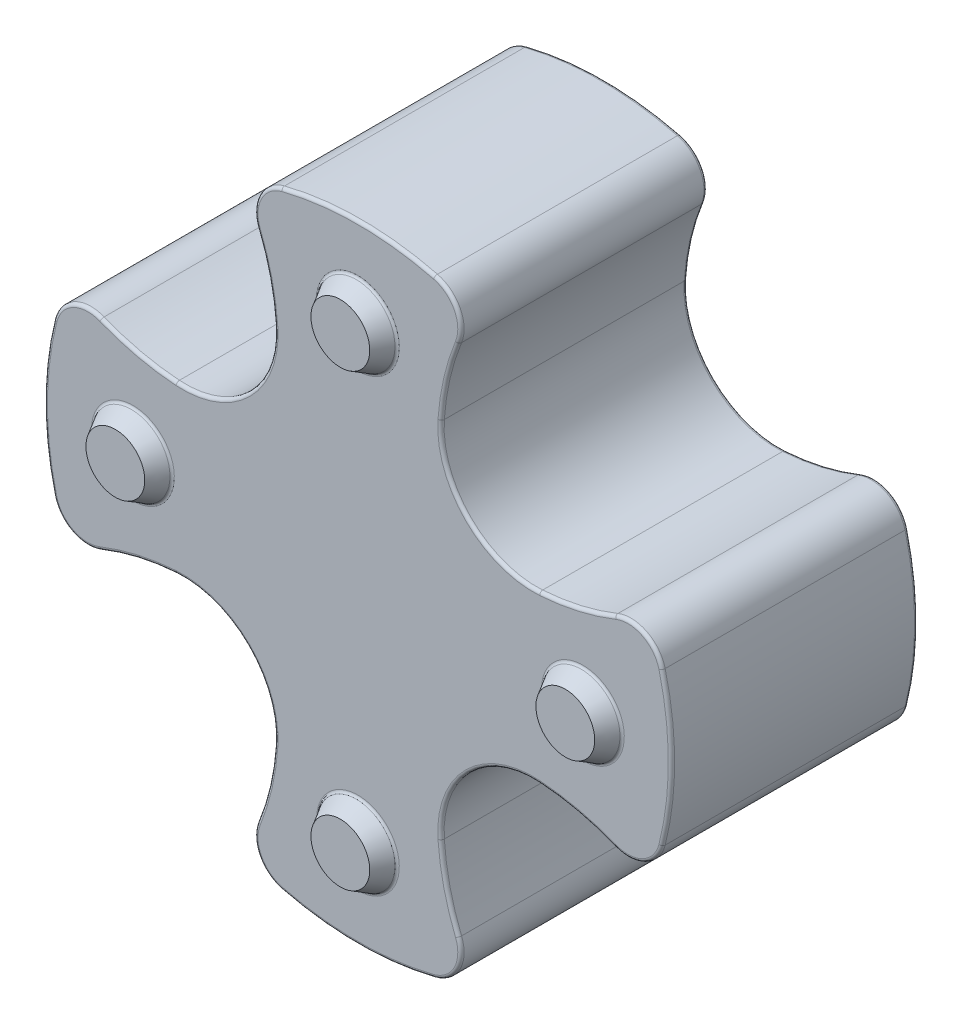
from build123d import *

# Parameters (mm, degrees)
BOSS_EXTRUDE1_DEPTH = 5.334
SKETCH5_R           = 1.7145
BOSS_EXTRUDE3_DEPTH = 0.762
BOSS_EXTRUDE3_TAPER = 30
CIRPATTERN1_COUNT   = 4
FILLET3_R           = 0.13716


with BuildPart() as part:
    # Sketch3 → Boss-Extrude1 (new body)
    with BuildSketch(Plane.XY):
        with BuildLine():
            Line((0, 0), (-4.768515788, 4.768516212))
            ThreePointArc((-4.768515788, 4.768516212), (-3.85125366, 6.193629783), (-3.606569915, 7.870665373))
            ThreePointArc((-3.606569915, 7.870665373), (-3.85264508, 9.530618394), (-4.355380176, 11.131635084))
            ThreePointArc((-4.355380176, 11.131635084), (-4.299852857, 12.392230924), (-3.313267616, 13.178891407))
            ThreePointArc((-3.313267616, 13.178891407), (0, 13.589), (3.313267616, 13.178891407))
            ThreePointArc((3.313267616, 13.178891407), (4.299852791, 12.392231053), (4.355380284, 11.131635354))
            ThreePointArc((4.355380284, 11.131635354), (3.852645214, 9.530617348), (3.606570473, 7.870663004))
            ThreePointArc((3.606570473, 7.870663004), (3.85125457, 6.19362848), (4.768516212, 4.768515788))
            Line((4.768516212, 4.768515788), (0, 0))
        make_face()
    extrude(amount=BOSS_EXTRUDE1_DEPTH)

    # Sketch5 → Boss-Extrude3 (add)
    with BuildSketch(Plane.XY.offset(5.334)):
        with Locations((0, 9.749626986)):
            Circle(SKETCH5_R)
    extrude(amount=BOSS_EXTRUDE3_DEPTH, taper=BOSS_EXTRUDE3_TAPER)


with BuildPart() as cirpattern1_1:
    # CirPattern1: pattern copy
    add(part.part.rotate(Axis((0, 0, 0), (0, 0, 1)), 1 * 360 / CIRPATTERN1_COUNT))


with BuildPart() as cirpattern1_2:
    # CirPattern1: pattern copy
    add(part.part.rotate(Axis((0, 0, 0), (0, 0, 1)), 2 * 360 / CIRPATTERN1_COUNT))


with BuildPart() as cirpattern1_3:
    # CirPattern1: pattern copy
    add(part.part.rotate(Axis((0, 0, 0), (0, 0, 1)), 3 * 360 / CIRPATTERN1_COUNT))


with BuildPart() as cirpattern1_1_1:
    add(cirpattern1_1.part)

    # Combine1: union part, CirPattern1_3, CirPattern1_2
    add(part.part)
    add(cirpattern1_3.part)
    add(cirpattern1_2.part)

    # Fillet3
    fillet3_edges = [cirpattern1_1_1.edges().sort_by_distance(p)[0] for p in [
        (-12.392231053, 4.299852791, 5.334),
        (-13.589, 0, 5.334),
        (-12.392230924, -4.299852857, 5.334),
        (-9.530618394, -3.85264508, 5.334),
        (-4.768516938, -4.768515063, 5.334),
        (-9.749626986, -1.7145, 5.334),
        (-4.768515063, 4.768516938, 5.334),
        (4.768516938, 4.768515063, 5.334),
        (3.852645214, 9.530617348, 5.334),
        (4.299852791, 12.392231053, 5.334),
        (0, 13.589, 5.334),
        (-4.299852857, 12.392230924, 5.334),
        (-3.85264508, 9.530618394, 5.334),
        (-3.852645214, -9.530617348, 5.334),
        (-4.299852791, -12.392231053, 5.334),
        (0, -13.589, 5.334),
        (4.299852857, -12.392230924, 5.334),
        (3.85264508, -9.530618394, 5.334),
        (4.768515063, -4.768516938, 5.334),
        (9.530617348, -3.852645214, 5.334),
        (12.392231053, -4.299852791, 5.334),
        (13.589, 0, 5.334),
        (12.392230924, 4.299852857, 5.334),
        (9.530618394, 3.85264508, 5.334),
        (-1.7145, 9.749626986, 5.334),
        (9.749626986, 1.7145, 5.334),
        (1.7145, -9.749626986, 5.334),
        (-9.530617348, 3.852645214, 5.334),
    ]]
    fillet(fillet3_edges, radius=FILLET3_R)

    # Mirror1: CirPattern1_1 across plane


with BuildPart() as cirpattern1_1_2:
    add(cirpattern1_1_1.part)
    add(cirpattern1_1_1.part.mirror(Plane(origin=(-7.596427209, 7.596427884, 0), x_dir=(1, 0, 0), z_dir=(0, 0, 1))))


solid = cirpattern1_1_2.part
